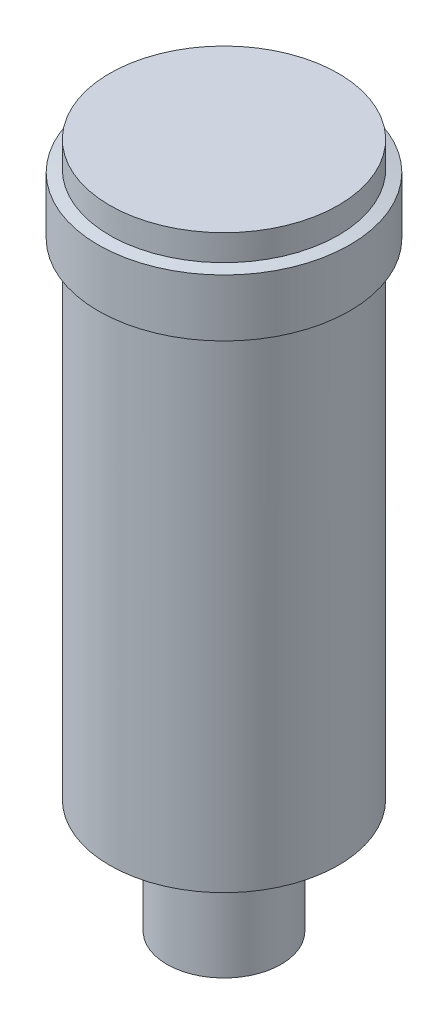
from build123d import *

# Parameters (mm, degrees)
SKETCH_1_R      = 1
EXTRUDE_1_DEPTH = 2
SKETCH_2_R      = 2
EXTRUDE_2_DEPTH = 10


with BuildPart() as part:
    # 草图1 → 凸台-拉伸1 (new body)
    with BuildSketch(Plane(origin=(0, 0, 0), x_dir=(1, 0, 0), z_dir=(0, 1, 0))):
        with Locations(Location((0, 0, 0), (0, 0, 270))):
            Circle(SKETCH_1_R)
    extrude(amount=EXTRUDE_1_DEPTH)

    # 草图2 → 凸台-拉伸2 (add)
    with BuildSketch(Plane(origin=(0, 2, 0), x_dir=(1, 0, 0), z_dir=(0, 1, 0))):
        with Locations(Location((0, 0, 0), (0, 0, 270))):
            Circle(SKETCH_2_R)
    extrude(amount=EXTRUDE_2_DEPTH)

    # 草图3 → 旋转1 (revolve)
    with BuildSketch(Plane.XY, mode=Mode.PRIVATE) as revolve_1_sk:
        Polygon((0, 12), (0, 10), (2.2, 10.5), (2.2, 11.5), align=None)
    revolve(revolve_1_sk.sketch.rotate(Axis((0, 12, 0), (0, -1, 0)), 180), axis=Axis((0, 12, 0), (0, -1, 0)))


solid = part.part
